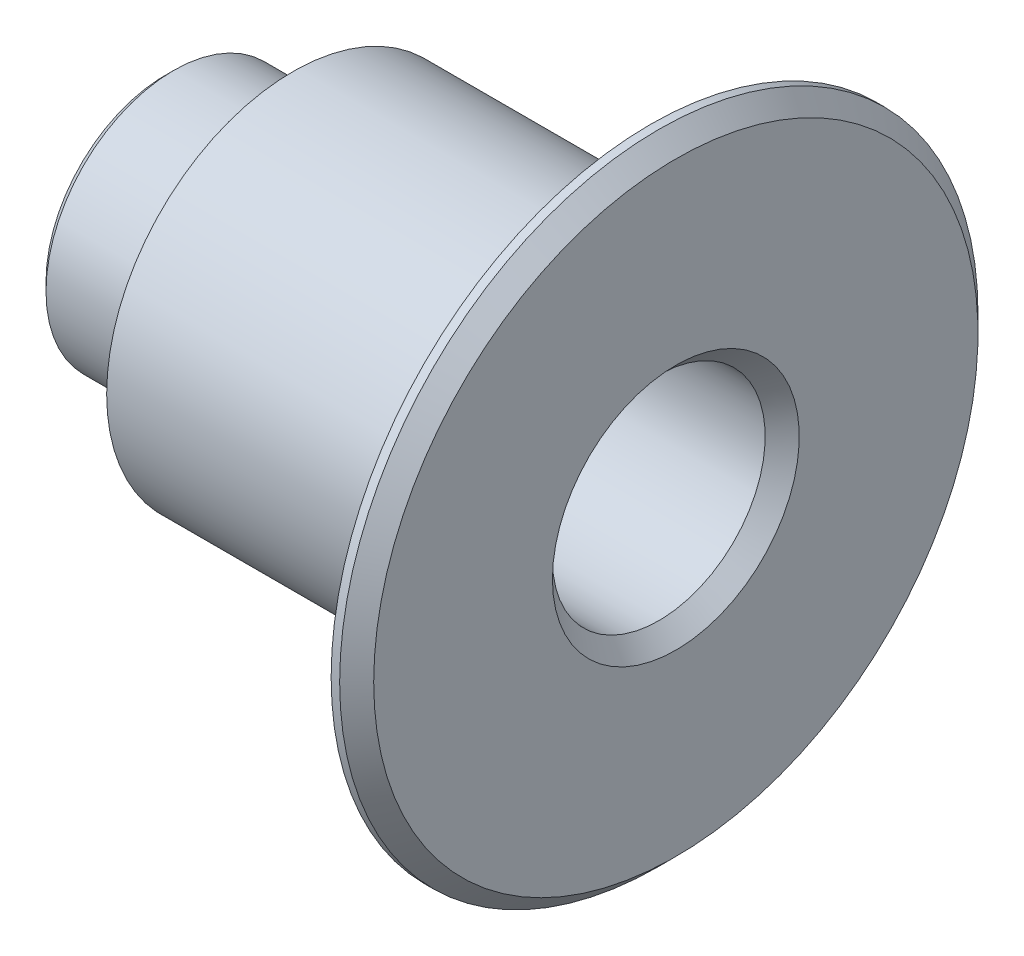
from build123d import *

# Parameters (mm, degrees)
CHAMFER1_SIZE = 0.254
CHAMFER2_SIZE = 0.508
CHAMFER3_SIZE = 0.508


with BuildPart() as part:
    # Sketch1 → Revolve1 (revolve)
    with BuildSketch(Plane(origin=(0, 0, 0), x_dir=(1, 0, 0), z_dir=(0, 1, 0)), mode=Mode.PRIVATE) as revolve1_sk:
        Polygon((-54.186066728, 7.169875811), (-57.996066728, 7.169875811), (-57.996066728, 6.534875811), (-42.756066728, 6.534875811), (-42.756066728, 12.884875811), (-43.518066728, 12.884875811), (-43.518066728, 8.916125811), (-54.186066728, 8.916125811), align=None)
    revolve(revolve1_sk.sketch.rotate(Axis((-57.996066728, 0, -3.359875811), (1, 0, 0)), 180), axis=Axis((-57.996066728, 0, -3.359875811), (1, 0, 0)))

    # Chamfer1
    chamfer1_edges = [part.edges().sort_by_distance(p)[0] for p in [
        (-57.996066728, 0, -7.169875811),
        (-57.996066728, 0, -6.534875811),
    ]]
    chamfer(chamfer1_edges, length=CHAMFER1_SIZE)

    # Chamfer2
    chamfer2_edges = [part.edges().sort_by_distance(p)[0] for p in [
        (-42.756066728, 0, -6.534875811),
    ]]
    chamfer(chamfer2_edges, length=CHAMFER2_SIZE)

    # Chamfer3
    chamfer3_edges = [part.edges().sort_by_distance(p)[0] for p in [
        (-42.756066728, 0, -12.884875811),
    ]]
    chamfer(chamfer3_edges, length=CHAMFER3_SIZE)


solid = part.part
